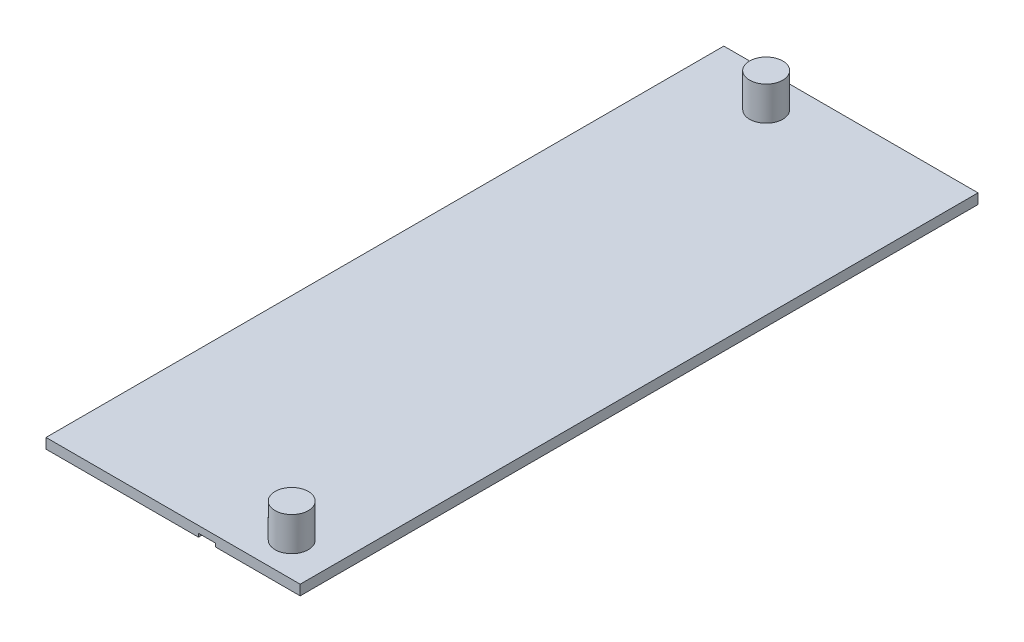
from build123d import *

# Parameters (mm, degrees)
SKETCH1_W           = 75
SKETCH1_H           = 3
BOSS_EXTRUDE1_DEPTH = 200
SKETCH2_R           = 4.9
BOSS_EXTRUDE2_DEPTH = 10
SKETCH3_W           = 7
SKETCH3_H           = 33
SKETCH3_W_2         = 5
SKETCH3_H_2         = 30
CUT_EXTRUDE1_DEPTH  = 1


with BuildPart() as part:
    # Sketch1 → Boss-Extrude1 (new body)
    with BuildSketch(Plane.XY):
        with Locations((37.5, 1.5)):
            Rectangle(SKETCH1_W, SKETCH1_H)
    extrude(amount=BOSS_EXTRUDE1_DEPTH)

    # Sketch2 → Boss-Extrude2 (add)
    with BuildSketch(Plane(origin=(0, 3, 0), x_dir=(1, 0, 0), z_dir=(0, 1, 0))):
        with Locations(Location((62.5, -190, 0), (0, 0, 90))):
            Circle(SKETCH2_R)
        with Locations(Location((22.5, -10, 0), (0, 0, 90))):
            Circle(SKETCH2_R)
    extrude(amount=BOSS_EXTRUDE2_DEPTH)

    # Sketch3 → Cut-Extrude1 (cut)
    with BuildSketch(Plane.XZ):
        with Locations((7.5, 26.5)):
            Rectangle(SKETCH3_W, SKETCH3_H)
        with Locations((7.5, 63.5)):
            Rectangle(SKETCH3_W, SKETCH3_H)
        with Locations((22.5, 26.5)):
            Rectangle(SKETCH3_W, SKETCH3_H)
        with Locations((22.5, 63.5)):
            Rectangle(SKETCH3_W, SKETCH3_H)
        with Locations((37.5, 26.5)):
            Rectangle(SKETCH3_W, SKETCH3_H)
        with Locations((37.5, 63.5)):
            Rectangle(SKETCH3_W, SKETCH3_H)
        with Locations((52.5, 26.5)):
            Rectangle(SKETCH3_W, SKETCH3_H)
        with Locations((52.5, 63.5)):
            Rectangle(SKETCH3_W, SKETCH3_H)
        with Locations((67.5, 26.5)):
            Rectangle(SKETCH3_W, SKETCH3_H)
        with Locations((67.5, 63.5)):
            Rectangle(SKETCH3_W, SKETCH3_H)
        with Locations((47.5, 185)):
            Rectangle(SKETCH3_W_2, SKETCH3_H_2)
        with Locations((47.5, 135)):
            Rectangle(SKETCH3_W_2, SKETCH3_H_2)
    extrude(amount=-CUT_EXTRUDE1_DEPTH, mode=Mode.SUBTRACT)


solid = part.part
